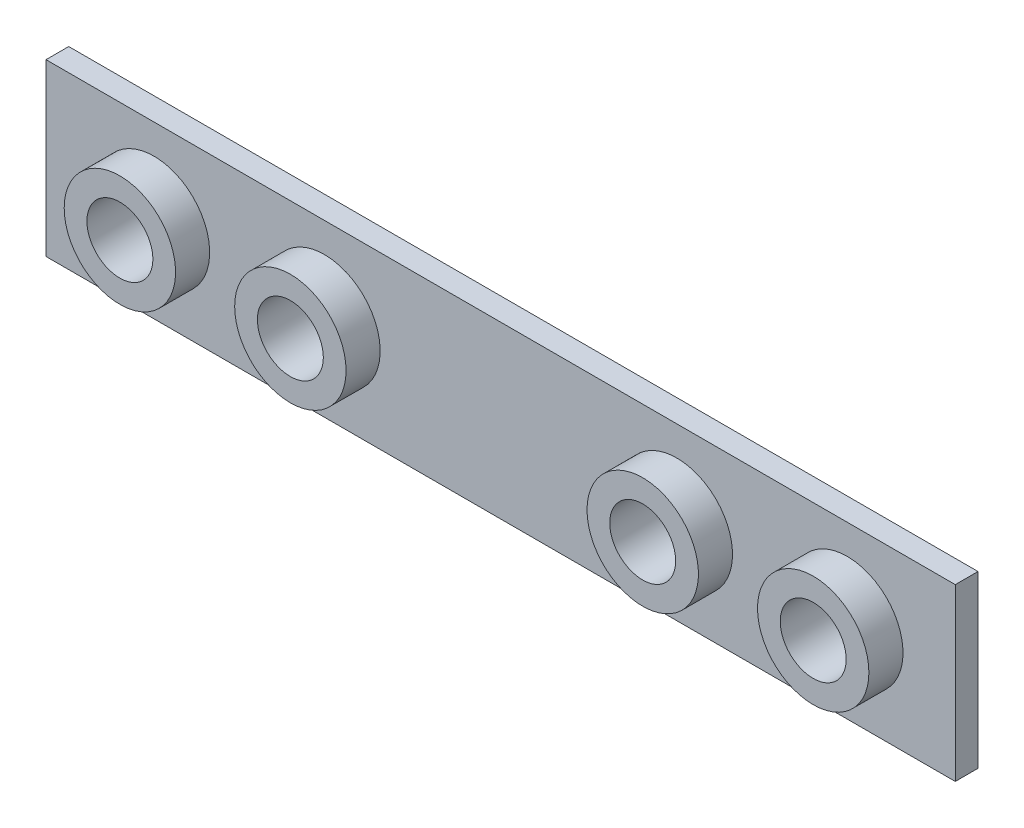
from build123d import *

# Parameters (mm, degrees)
SKETCH1_R             = 4.9
SKETCH1_R_2           = 2.9
BOSS_EXTRUDE1_DEPTH   = 5
BOSS_EXTRUDE1_2_DEPTH = 5
BOSS_EXTRUDE1_3_DEPTH = 5
BOSS_EXTRUDE1_4_DEPTH = 5
SKETCH3_W             = 80
SKETCH3_H             = 15
BOSS_EXTRUDE2_DEPTH   = 2
SKETCH4_R             = 2.9
CUT_EXTRUDE1_DEPTH    = 42.003048667


with BuildPart() as part:
    # Sketch1 → Boss-Extrude1 (new body)
    with BuildSketch(Plane.XY):
        with Locations((-15.5, 0)):
            Circle(SKETCH1_R)
        with Locations((-15.5, 0)):
            Circle(SKETCH1_R_2, mode=Mode.SUBTRACT)
    extrude(amount=BOSS_EXTRUDE1_DEPTH)



with BuildPart() as body_2:
    # Sketch1 → Boss-Extrude1 2 (new body)
    with BuildSketch(Plane.XY):
        with Locations(Location((-30.5, 0, 0), (0, 0, 180))):
            Circle(SKETCH1_R)
        with Locations(Location((-30.5, 0, 0), (0, 0, 180))):
            Circle(SKETCH1_R_2, mode=Mode.SUBTRACT)
    extrude(amount=BOSS_EXTRUDE1_2_DEPTH)


with BuildPart() as body_3:
    # Sketch1 → Boss-Extrude1 3 (new body)
    with BuildSketch(Plane.XY):
        with Locations(Location((15.5, 0, 0), (0, 0, 180))):
            Circle(SKETCH1_R)
        with Locations(Location((15.5, 0, 0), (0, 0, 180))):
            Circle(SKETCH1_R_2, mode=Mode.SUBTRACT)
    extrude(amount=BOSS_EXTRUDE1_3_DEPTH)


with BuildPart() as body_4:
    # Sketch1 → Boss-Extrude1 4 (new body)
    with BuildSketch(Plane.XY):
        with Locations((30.5, 0)):
            Circle(SKETCH1_R)
        with Locations((30.5, 0)):
            Circle(SKETCH1_R_2, mode=Mode.SUBTRACT)
    extrude(amount=BOSS_EXTRUDE1_4_DEPTH)


with BuildPart() as part_1:
    add(part.part)

    add(body_2.part)  # Boss-Extrude2 merges body 2

    add(body_3.part)  # Boss-Extrude2 merges body 3

    add(body_4.part)  # Boss-Extrude2 merges body 4
    # Sketch3 → Boss-Extrude2 (add)
    with BuildSketch(Plane.XY):
        Rectangle(SKETCH3_W, SKETCH3_H)
    extrude(amount=BOSS_EXTRUDE2_DEPTH)

    # Sketch4 → Cut-Extrude1 (cut, through all)
    with BuildSketch(Plane.XY.offset(5)):
        with Locations(Location((-30.5, 0, 0), (0, 0, 180))):
            Circle(SKETCH4_R)
        with Locations((-15.5, 0)):
            Circle(SKETCH4_R)
        with Locations(Location((15.5, 0, 0), (0, 0, 180))):
            Circle(SKETCH4_R)
        with Locations((30.5, 0)):
            Circle(SKETCH4_R)
    extrude(amount=-CUT_EXTRUDE1_DEPTH, mode=Mode.SUBTRACT)


solid = part_1.part
